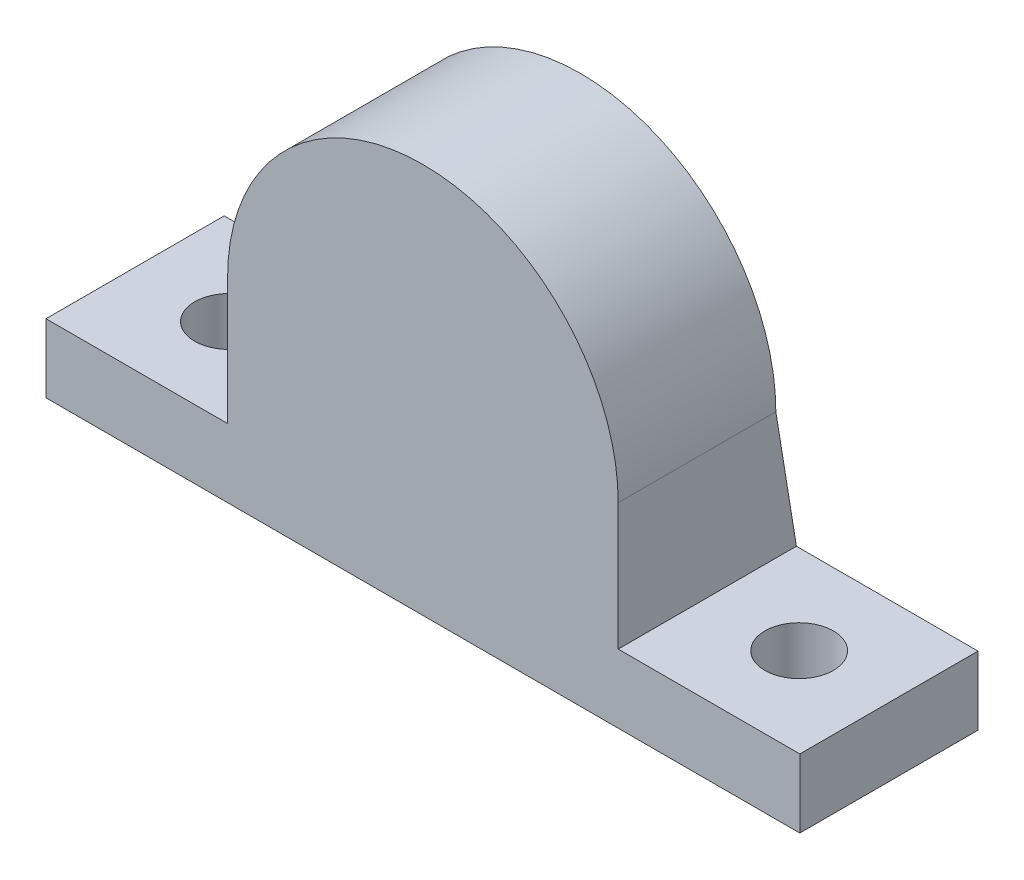
from build123d import *

# Parameters (mm, degrees)
CROQUIS1_W                   = 55
CROQUIS1_H                   = 13
SALIENTE_EXTRUIR1_DEPTH      = 5
CROQUIS2_R                   = 2.5
CORTAR_EXTRUIR1_DEPTH        = 5
CROQUIS3_W                   = 26
CROQUIS3_H                   = 5
CORTAR_EXTRUIR2_DEPTH        = 5
SALIENTE_EXTRUIR2_DEPTH      = 5
SALIENTE_EXTRUIR2_DEPTH_BACK = 8
CROQUIS4_R                   = 14.25
CROQUIS5_R                   = 12
CORTAR_EXTRUIR3_DEPTH        = 1
CORTAR_EXTRUIR4_START        = -1
CROQUIS6_R                   = 12
CORTAR_EXTRUIR4_DEPTH        = 1
SALIENTE_EXTRUIR3_DEPTH      = 1
SALIENTE_EXTRUIR3_DEPTH_BACK = 12
SALIENTE_EXTRUIR4_DEPTH      = 13
CROQUIS9_R                   = 11
CORTAR_EXTRUIR5_DEPTH        = 13
CROQUIS10_W                  = 30.554627906
CROQUIS10_H                  = 17.725009208
CORTAR_EXTRUIR6_DEPTH        = 1.5
CROQUIS11_W                  = 31.627471091
CROQUIS11_H                  = 18.560833894
CORTAR_EXTRUIR7_DEPTH        = 1.5
CORTAR_EXTRUIR8_START        = -1.5
CROQUIS13_R                  = 12
CORTAR_EXTRUIR8_DEPTH        = 1.5
CROQUIS14_R                  = 12
CORTAR_EXTRUIR10_DEPTH       = 1.5
CORTAR_EXTRUIR11_START       = 5
CROQUIS15_R                  = 12
CORTAR_EXTRUIR11_DEPTH       = 5
CROQUIS16_R                  = 12
CORTAR_EXTRUIR12_DEPTH       = 5
CORTAR_EXTRUIR13_DEPTH       = 20
CORTAR_EXTRUIR14_DEPTH       = 36
CORTAR_EXTRUIR15_DEPTH       = 36
CORTAR_EXTRUIR16_DEPTH       = 23
CROQUIS22_R                  = 12
SALIENTE_EXTRUIR6_DEPTH      = 1.5
CROQUIS23_R                  = 14.25
SALIENTE_EXTRUIR7_DEPTH      = 1.5
SALIENTE_EXTRUIR9_DEPTH      = 5
SALIENTE_EXTRUIR10_DEPTH     = 5
SALIENTE_EXTRUIR11_START     = -1.5
SALIENTE_EXTRUIR11_DEPTH     = 1.5
SALIENTE_EXTRUIR12_START     = -1.5
SALIENTE_EXTRUIR12_DEPTH     = 1.5
SALIENTE_EXTRUIR13_START     = -10
CROQUIS30_R                  = 11.125
CROQUIS30_R_2                = 11
SALIENTE_EXTRUIR13_DEPTH     = 10
CROQUIS31_R                  = 11.125
CORTAR_EXTRUIR17_DEPTH       = 7
CROQUIS32_R                  = 11.25
CORTAR_EXTRUIR18_DEPTH       = 7


with BuildPart() as part:
    # Croquis1 → Saliente-Extruir1 (new body)
    with BuildSketch(Plane(origin=(0, 0, 0), x_dir=(1, 0, 0), z_dir=(0, 1, 0))):
        Rectangle(CROQUIS1_W, CROQUIS1_H)
    extrude(amount=SALIENTE_EXTRUIR1_DEPTH)

    # Croquis2 → Cortar-Extruir1 (cut)
    with BuildSketch(Plane(origin=(0, 5, 0), x_dir=(1, 0, 0), z_dir=(0, 1, 0))):
        with Locations(Location((-20.65, 0, 0), (0, 0, 270))):
            Circle(CROQUIS2_R)
        with Locations(Location((20.95, 0, 0), (0, 0, 270))):
            Circle(CROQUIS2_R)
    extrude(amount=-CORTAR_EXTRUIR1_DEPTH, mode=Mode.SUBTRACT)

    # Croquis3 → Cortar-Extruir2 (cut)
    with BuildSketch(Plane(origin=(0, 5, 0), x_dir=(1, 0, 0), z_dir=(0, 1, 0))):
        with Locations((0, 4)):
            Rectangle(CROQUIS3_W, CROQUIS3_H)
        with Locations((0, -4)):
            Rectangle(CROQUIS3_W, CROQUIS3_H)
    extrude(amount=-CORTAR_EXTRUIR2_DEPTH, mode=Mode.SUBTRACT)

    # Croquis4 → Saliente-Extruir2 (add, two sides: drawn at the far end of the back side and taken through both)
    with BuildSketch(Plane.XY.offset(1.5).offset(-SALIENTE_EXTRUIR2_DEPTH_BACK)):
        with Locations((0, 14.25)):
            Circle(CROQUIS4_R)
    extrude(amount=SALIENTE_EXTRUIR2_DEPTH + SALIENTE_EXTRUIR2_DEPTH_BACK)

    # Croquis5 → Cortar-Extruir3 (cut)
    with BuildSketch(Plane(origin=(0, 0, -6.5), x_dir=(-1, 0, 0), z_dir=(0, 0, -1))):
        with Locations((0, 14.25)):
            Circle(CROQUIS5_R)
    extrude(amount=-CORTAR_EXTRUIR3_DEPTH, mode=Mode.SUBTRACT)

    # Croquis6 → Cortar-Extruir4 (cut)
    with BuildSketch(Plane.XY.offset(6.5).offset(CORTAR_EXTRUIR4_START)):
        with Locations(Location((0, 14.25, 0), (0, 0, 180))):
            Circle(CROQUIS6_R)
    extrude(amount=CORTAR_EXTRUIR4_DEPTH, mode=Mode.SUBTRACT)

    # Croquis7 → Saliente-Extruir3 (add, two sides: drawn at the far end of the back side and taken through both)
    with BuildSketch(Plane.XY.offset(5.5).offset(-SALIENTE_EXTRUIR3_DEPTH_BACK)):
        Polygon((-12, 14.25), (-13, 0), (-14.25, 5), (-14.25, 14.25), align=None)
        Polygon((12, 14.25), (13, 0), (14.25, 5), (14.25, 14.25), align=None)
    extrude(amount=SALIENTE_EXTRUIR3_DEPTH + SALIENTE_EXTRUIR3_DEPTH_BACK)

    # Croquis8 → Saliente-Extruir4 (add)
    with BuildSketch(Plane.XY.offset(6.5)):
        Polygon((-10.839741694, 5), (-13.183687754, 5), (-12.649122807, 8.463153797), align=None)
        Polygon((12.728523578, 8.463153797), (12.649122807, 5), (10.839741694, 5), align=None)
    extrude(amount=-SALIENTE_EXTRUIR4_DEPTH)

    # Croquis9 → Cortar-Extruir5 (cut)
    with BuildSketch(Plane.XY.offset(5.5)):
        with Locations((0, 14.25)):
            Circle(CROQUIS9_R)
    extrude(amount=-CORTAR_EXTRUIR5_DEPTH, mode=Mode.SUBTRACT)

    # Croquis10 → Cortar-Extruir6 (cut)
    with BuildSketch(Plane(origin=(0, 0, -6.5), x_dir=(-1, 0, 0), z_dir=(0, 0, -1))):
        with Locations((1.027313953, 23.112504604)):
            Rectangle(CROQUIS10_W, CROQUIS10_H)
    extrude(amount=-CORTAR_EXTRUIR6_DEPTH, mode=Mode.SUBTRACT)

    # Croquis11 → Cortar-Extruir7 (cut)
    with BuildSketch(Plane.XY.offset(6.5)):
        with Locations((-1.563735546, 23.530416947)):
            Rectangle(CROQUIS11_W, CROQUIS11_H)
    extrude(amount=-CORTAR_EXTRUIR7_DEPTH, mode=Mode.SUBTRACT)

    # Croquis13 → Cortar-Extruir8 (cut)
    with BuildSketch(Plane.XY.offset(5).offset(CORTAR_EXTRUIR8_START)):
        with Locations((0, 14.25)):
            Circle(CROQUIS13_R)
    extrude(amount=CORTAR_EXTRUIR8_DEPTH, mode=Mode.SUBTRACT)

    # Croquis14 → Cortar-Extruir10 (cut)
    with BuildSketch(Plane(origin=(0, 0, -5), x_dir=(-1, 0, 0), z_dir=(0, 0, -1))):
        with Locations(Location((0, 14.25, 0), (0, 0, 180))):
            Circle(CROQUIS14_R)
    extrude(amount=-CORTAR_EXTRUIR10_DEPTH, mode=Mode.SUBTRACT)

    # Croquis15 → Cortar-Extruir11 (cut)
    with BuildSketch(Plane(origin=(0, 0, -3.5), x_dir=(-1, 0, 0), z_dir=(0, 0, -1)).offset(CORTAR_EXTRUIR11_START)):
        with Locations((0, 14.25)):
            Circle(CROQUIS15_R)
    extrude(amount=-CORTAR_EXTRUIR11_DEPTH, mode=Mode.SUBTRACT)

    # Croquis16 → Cortar-Extruir12 (cut)
    with BuildSketch(Plane.XY.offset(3.5)):
        with Locations(Location((0, 14.25, 0), (0, 0, 180))):
            Circle(CROQUIS16_R)
    extrude(amount=CORTAR_EXTRUIR12_DEPTH, mode=Mode.SUBTRACT)

    # Croquis17 → Cortar-Extruir13 (cut)
    with BuildSketch(Plane.XY.offset(5)):
        Polygon((-12, 14.25), (-13, 0), (13, 0), (12, 14.25), align=None)
    extrude(amount=CORTAR_EXTRUIR13_DEPTH, mode=Mode.SUBTRACT)

    # Croquis18 → Cortar-Extruir14 (cut)
    with BuildSketch(Plane.ZY.offset(14.25)):
        Polygon((5, 14.25), (6.5, 5), (6.5, 14.25), align=None)
    extrude(amount=-CORTAR_EXTRUIR14_DEPTH, mode=Mode.SUBTRACT)

    # Croquis19 → Cortar-Extruir15 (cut)
    with BuildSketch(Plane(origin=(14.25, 0, 0), x_dir=(0, 0, -1), z_dir=(1, 0, 0))):
        Polygon((5, 14.25), (6.5, 5), (6.5, 14.25), align=None)
    extrude(amount=-CORTAR_EXTRUIR15_DEPTH, mode=Mode.SUBTRACT)

    # Croquis20 → Cortar-Extruir16 (cut)
    with BuildSketch(Plane(origin=(0, 0, -5), x_dir=(-1, 0, 0), z_dir=(0, 0, -1))):
        Polygon((-12, 14.25), (-13, 0), (13, 0), (12, 14.25), align=None)
    extrude(amount=CORTAR_EXTRUIR16_DEPTH, mode=Mode.SUBTRACT)

    # Croquis22 → Saliente-Extruir6 (add)
    with BuildSketch(Plane.XY.offset(3.5)):
        with Locations(Location((0, 14.25, 0), (0, 0, 180))):
            Circle(CROQUIS22_R)
    extrude(amount=SALIENTE_EXTRUIR6_DEPTH)

    # Croquis23 → Saliente-Extruir7 (add)
    with BuildSketch(Plane.XY.offset(5)):
        with Locations((0, 14.25)):
            Circle(CROQUIS23_R)
    extrude(amount=SALIENTE_EXTRUIR7_DEPTH)

    # Croquis24 → Saliente-Extruir9 (add)
    with BuildSketch(Plane.XY.offset(1.5)):
        with BuildLine():
            Line((-10.839741694, 5), (-12.649122807, 5))
            Line((-12.649122807, 5), (-13, 0))
            Line((-13, 0), (0, 0))
            ThreePointArc((0, 0), (-5.968668193, 1.310235705), (-10.839741694, 5))
        make_face()
    extrude(amount=SALIENTE_EXTRUIR9_DEPTH)

    # Croquis26 → Saliente-Extruir10 (add)
    with BuildSketch(Plane.XY.offset(1.5)):
        with BuildLine():
            Line((0, 0), (13, 0))
            Line((13, 0), (12.649122807, 5))
            Line((12.649122807, 5), (10.839741694, 5))
            ThreePointArc((10.839741694, 5), (5.968668193, 1.310235705), (0, 0))
        make_face()
    extrude(amount=SALIENTE_EXTRUIR10_DEPTH)

    # Croquis27 → Saliente-Extruir11 (add)
    with BuildSketch(Plane.XY.offset(6.5).offset(SALIENTE_EXTRUIR11_START)):
        with BuildLine():
            Line((-12.649122807, 5), (-10.839741694, 5))
            ThreePointArc((-10.839741694, 5), (-13.370280834, 9.320690674), (-14.25, 14.25))
            Line((-14.25, 14.25), (-14.25, 5))
            Line((-14.25, 5), (-12.649122807, 5))
        make_face()
    extrude(amount=SALIENTE_EXTRUIR11_DEPTH)

    # Croquis28 → Saliente-Extruir12 (add)
    with BuildSketch(Plane.XY.offset(6.5).offset(SALIENTE_EXTRUIR12_START)):
        with BuildLine():
            ThreePointArc((14.25, 14.25), (13.370280834, 9.320690674), (10.839741694, 5))
            Line((10.839741694, 5), (12.649122807, 5))
            Line((12.649122807, 5), (14.25, 5))
            Line((14.25, 5), (14.25, 14.25))
        make_face()
    extrude(amount=SALIENTE_EXTRUIR12_DEPTH)

    # Croquis30 → Saliente-Extruir13 (add)
    with BuildSketch(Plane(origin=(0, 0, -3.5), x_dir=(-1, 0, 0), z_dir=(0, 0, -1)).offset(SALIENTE_EXTRUIR13_START)):
        with Locations((0, 14.25)):
            Circle(CROQUIS30_R)
        with Locations(Location((0, 14.25, 0), (0, 0, 180))):
            Circle(CROQUIS30_R_2, mode=Mode.SUBTRACT)
    extrude(amount=SALIENTE_EXTRUIR13_DEPTH)

    # Croquis31 → Cortar-Extruir17 (cut)
    with BuildSketch(Plane(origin=(0, 0, -3.5), x_dir=(-1, 0, 0), z_dir=(0, 0, -1))):
        with Locations((0, 14.25)):
            Circle(CROQUIS31_R)
    extrude(amount=-CORTAR_EXTRUIR17_DEPTH, mode=Mode.SUBTRACT)

    # Croquis32 → Cortar-Extruir18 (cut)
    with BuildSketch(Plane(origin=(0, 0, -3.5), x_dir=(-1, 0, 0), z_dir=(0, 0, -1))):
        with Locations((0, 14.25)):
            Circle(CROQUIS32_R)
    extrude(amount=-CORTAR_EXTRUIR18_DEPTH, mode=Mode.SUBTRACT)


solid = part.part
